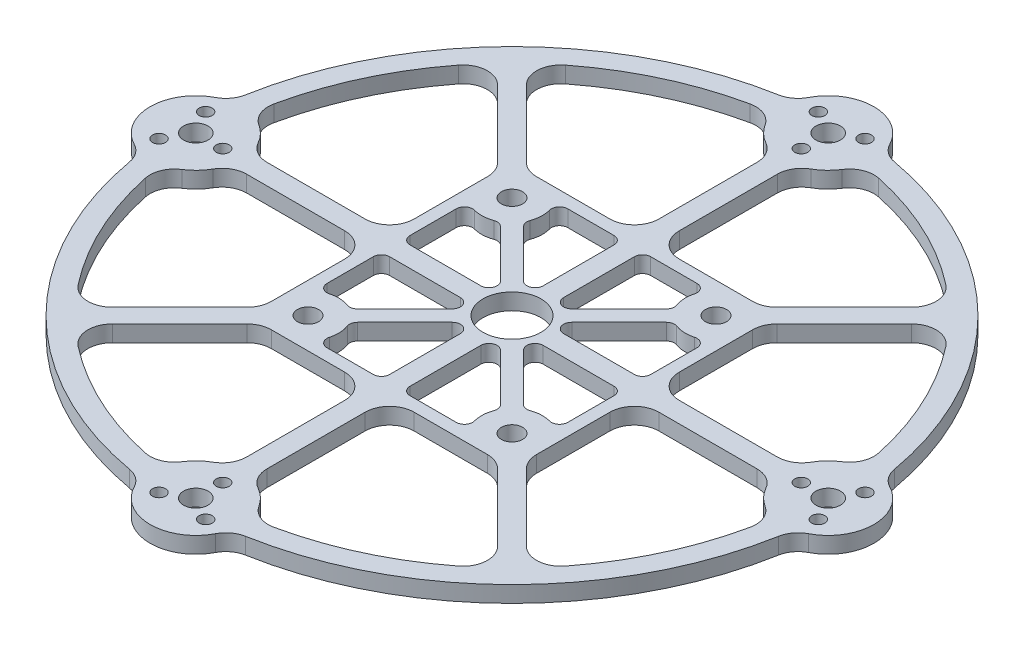
from build123d import *

# Parameters (mm, degrees)
SKETCH1_W               = 32.5
SKETCH1_H               = 32.5
BOSS_EXTRUDE1_DEPTH     = 1
M2_CLEARANCE_HOLE1_D    = 2.6
SKETCH7_R               = 0.8
SKETCH7_R_2             = 1.5
BOSS_EXTRUDE2_DEPTH     = 2
CIRPATTERN1_COUNT       = 4
BOSS_EXTRUDE3_DEPTH     = 2
CIRPATTERN3_COUNT       = 4
CUT_EXTRUDE2_DEPTH      = 63.752250956
CIRPATTERN4_COUNT       = 4
FILLET2_R               = 1
CUT_EXTRUDE3_DEPTH      = 63.752250956
CUT_EXTRUDE3_DEPTH_BACK = 63.752250956
SKETCH15_R              = 3.554540671
BOSS_EXTRUDE4_DEPTH     = 2
CIRPATTERN5_COUNT       = 4
FILLET1_R               = 3


with BuildPart() as part:
    # Sketch1 → Boss-Extrude1 (new, symmetric)
    with BuildSketch(Plane(origin=(0, 0, 0), x_dir=(1, 0, 0), z_dir=(0, 1, 0))):
        Rectangle(SKETCH1_W, SKETCH1_H)
    extrude(amount=BOSS_EXTRUDE1_DEPTH, both=True)

    # M2 Clearance Hole1 (through all)
    with Locations(Plane(origin=(0, 1, 0), x_dir=(1, 0, 0), z_dir=(0, 1, 0))):
        with Locations((-12.5, -12.5), (-12.5, 12.5), (12.5, -12.5), (12.5, 12.5)):
            Hole(M2_CLEARANCE_HOLE1_D / 2)

    # Sketch7 → Boss-Extrude2 (add)
    with BuildSketch(Plane.XZ.offset(1)):
        with BuildLine():
            Line((16.25, -1.25), (33.291291362, -1.25))
            ThreePointArc((33.291291362, -1.25), (44.35, 0), (33.291291362, 1.25))
            Line((33.291291362, 1.25), (16.25, 1.25))
            Line((16.25, 1.25), (16.25, -1.25))
        make_face()
        with Locations(Location((40.4, 2.857883832, 0), (0, 0, 270))):
            Circle(SKETCH7_R, mode=Mode.SUBTRACT)
        with Locations(Location((40.4, -2.857883832, 0), (0, 0, 270))):
            Circle(SKETCH7_R, mode=Mode.SUBTRACT)
        with Locations(Location((35.45, 0, 0), (0, 0, 270))):
            Circle(SKETCH7_R, mode=Mode.SUBTRACT)
        with Locations(Location((38.75, 0, 0), (0, 0, 270))):
            Circle(SKETCH7_R_2, mode=Mode.SUBTRACT)
    boss_extrude2 = extrude(amount=-BOSS_EXTRUDE2_DEPTH)

    # CirPattern1: Boss-Extrude2 ×4 about axis
    cirpattern1_axis = Axis((0, 0, 0), (0, 1, 0))
    for i in range(1, CIRPATTERN1_COUNT):
        add(boss_extrude2.rotate(cirpattern1_axis, i * 360 / CIRPATTERN1_COUNT))

    # Sketch13 → Boss-Extrude3 (add)
    with BuildSketch(Plane.XZ.offset(1)):
        with BuildLine():
            ThreePointArc((-5.45586778, -37.487658222), (-26.787039891, -26.787039891), (-37.487658222, -5.45586778))
            ThreePointArc((-37.487658222, -5.45586778), (-38.75, -5.6), (-40.012341778, -5.45586778))
            ThreePointArc((-40.012341778, -5.45586778), (-28.554806844, -28.554806844), (-5.45586778, -40.012341778))
            ThreePointArc((-5.45586778, -40.012341778), (-5.6, -38.75), (-5.45586778, -37.487658222))
        make_face()
    boss_extrude3 = extrude(amount=-BOSS_EXTRUDE3_DEPTH)

    # CirPattern3: Boss-Extrude3 ×4 about axis
    cirpattern3_axis = Axis((0, 0, 0), (0, -1, 0))
    for i in range(1, CIRPATTERN3_COUNT):
        add(boss_extrude3.rotate(cirpattern3_axis, i * 360 / CIRPATTERN3_COUNT))

    # Sketch14 → Cut-Extrude2 (cut, symmetric)
    with BuildSketch(Plane(origin=(0, 1, 0), x_dir=(1, 0, 0), z_dir=(0, 1, 0))):
        with BuildLine():
            Line((-14.75, -1.25), (-14.75, -9.5))
            ThreePointArc((-14.75, -9.5), (-12.739903071, -8.757681666), (-10.651475744, -9.237262181))
            Line((-10.651475744, -9.237262181), (-2.664213562, -1.25))
            Line((-2.664213562, -1.25), (-14.75, -1.25))
        make_face()
        with BuildLine():
            Line((-1.25, -14.75), (-1.25, -2.664213562))
            Line((-1.25, -2.664213562), (-9.237262181, -10.651475744))
            ThreePointArc((-9.237262181, -10.651475744), (-8.757681666, -12.739903071), (-9.5, -14.75))
            Line((-9.5, -14.75), (-1.25, -14.75))
        make_face()
    cut_extrude2 = extrude(amount=CUT_EXTRUDE2_DEPTH, both=True, mode=Mode.SUBTRACT)

    # CirPattern4: Cut-Extrude2 ×4 about axis
    cirpattern4_axis = Axis((0, 0, 0), (0, 1, 0))
    for i in range(1, CIRPATTERN4_COUNT):
        add(cut_extrude2.rotate(cirpattern4_axis, i * 360 / CIRPATTERN4_COUNT), mode=Mode.SUBTRACT)

    # Fillet2
    fillet2_edges = [part.edges().sort_by_distance(p)[0] for p in [
        (1.25, 0, 14.75),
        (9.5, 0, 14.75),
        (9.237262181, 0, 10.651475744),
        (1.25, 0, 2.664213562),
        (10.651475744, 0, 9.237262181),
        (14.75, 0, 9.5),
        (14.75, 0, 1.25),
        (2.664213562, 0, 1.25),
        (14.75, 0, -1.25),
        (9.237262181, 0, -10.651475744),
        (1.25, 0, -2.664213562),
        (2.664213562, 0, -1.25),
        (10.651475744, 0, -9.237262181),
        (14.75, 0, -9.5),
        (9.5, 0, -14.75),
        (1.25, 0, -14.75),
        (-10.651475744, 0, 9.237262181),
        (-2.664213562, 0, -1.25),
        (-9.237262181, 0, -10.651475744),
        (-1.25, 0, 14.75),
        (-14.75, 0, 9.5),
        (-14.75, 0, 1.25),
        (-9.237262181, 0, 10.651475744),
        (-9.5, 0, 14.75),
        (-10.651475744, 0, -9.237262181),
        (-1.25, 0, 2.664213562),
        (-2.664213562, 0, 1.25),
        (-1.25, 0, -14.75),
        (-14.75, 0, -1.25),
        (-1.25, 0, -2.664213562),
        (-14.75, 0, -9.5),
        (-9.5, 0, -14.75),
    ]]
    fillet(fillet2_edges, radius=FILLET2_R)

    # Sketch15 → Cut-Extrude3 (cut, two sides: drawn at the far end of the back side and taken through both)
    with BuildSketch(Plane(origin=(0, 1, 0), x_dir=(1, 0, 0), z_dir=(0, 1, 0)).offset(-CUT_EXTRUDE3_DEPTH_BACK)):
        with Locations(Location((0, 0, 0), (0, 0, 270))):
            Circle(SKETCH15_R)
    extrude(amount=CUT_EXTRUDE3_DEPTH + CUT_EXTRUDE3_DEPTH_BACK, mode=Mode.SUBTRACT)

    # Sketch16 → Boss-Extrude4 (add)
    with BuildSketch(Plane.XZ.offset(1)):
        with BuildLine():
            Line((14.482233047, -16.25), (25.888569831, -27.656336784))
            ThreePointArc((25.888569831, -27.656336784), (26.787039891, -26.787039891), (27.656336784, -25.888569831))
            Line((27.656336784, -25.888569831), (16.25, -14.482233047))
            Line((16.25, -14.482233047), (16.25, -16.25))
            Line((16.25, -16.25), (14.482233047, -16.25))
        make_face()
    boss_extrude4 = extrude(amount=-BOSS_EXTRUDE4_DEPTH)

    # CirPattern5: Boss-Extrude4 ×4 about axis
    cirpattern5_axis = Axis((0, 0, 0), (0, 1, 0))
    for i in range(1, CIRPATTERN5_COUNT):
        add(boss_extrude4.rotate(cirpattern5_axis, i * 360 / CIRPATTERN5_COUNT))

    # Fillet1
    fillet1_edges = [part.edges().sort_by_distance(p)[0] for p in [
        (-37.487658222, 0, -5.45586778),
        (-40.012341778, 0, -5.45586778),
        (-5.45586778, 0, -40.012341778),
        (-5.45586778, 0, -37.487658222),
        (5.45586778, 0, -37.487658222),
        (5.45586778, 0, -40.012341778),
        (40.012341778, 0, -5.45586778),
        (37.487658222, 0, -5.45586778),
        (37.487658222, 0, 5.45586778),
        (40.012341778, 0, 5.45586778),
        (5.45586778, 0, 40.012341778),
        (5.45586778, 0, 37.487658222),
        (-5.45586778, 0, 37.487658222),
        (-5.45586778, 0, 40.012341778),
        (-40.012341778, 0, 5.45586778),
        (-37.487658222, 0, 5.45586778),
        (33.291291362, 0, -1.25),
        (16.25, 0, -1.25),
        (16.25, 0, 1.25),
        (33.291291362, 0, 1.25),
        (1.25, 0, 33.291291362),
        (1.25, 0, 16.25),
        (-1.25, 0, 16.25),
        (-1.25, 0, 33.291291362),
        (-33.291291362, 0, 1.25),
        (-16.25, 0, 1.25),
        (-16.25, 0, -1.25),
        (25.888569831, 0, -27.656336784),
        (27.656336784, 0, -25.888569831),
        (16.25, 0, -14.482233047),
        (14.482233047, 0, -16.25),
        (-33.291291362, 0, -1.25),
        (27.656336784, 0, 25.888569831),
        (25.888569831, 0, 27.656336784),
        (14.482233047, 0, 16.25),
        (16.25, 0, 14.482233047),
        (-25.888569831, 0, 27.656336784),
        (-27.656336784, 0, 25.888569831),
        (-16.25, 0, 14.482233047),
        (-14.482233047, 0, 16.25),
        (-27.656336784, 0, -25.888569831),
        (-25.888569831, 0, -27.656336784),
        (-14.482233047, 0, -16.25),
        (-16.25, 0, -14.482233047),
        (-1.25, 0, -33.291291362),
        (-1.25, 0, -16.25),
        (1.25, 0, -16.25),
        (1.25, 0, -33.291291362),
    ]]
    fillet(fillet1_edges, radius=FILLET1_R)


solid = part.part
